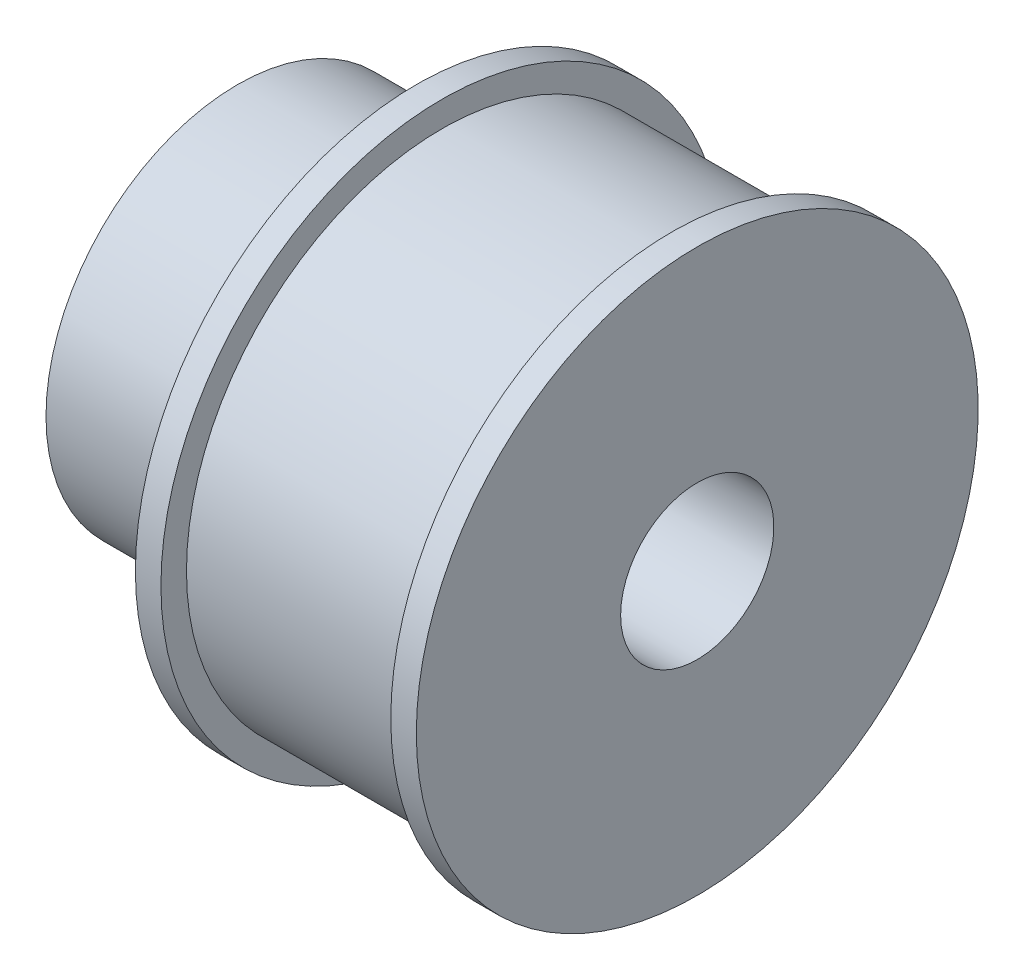
from build123d import *


with BuildPart() as part:
    # Sketch1 → Revolve1 (revolve)
    with BuildSketch(Plane(origin=(0, 0, 0), x_dir=(1, 0, 0), z_dir=(0, 1, 0)), mode=Mode.PRIVATE) as revolve1_sk:
        Polygon((0, 3), (0, 7.5), (7, 7.5), (7, 11), (8, 11), (8, 10), (17, 10), (17, 11), (18, 11), (18, 3), align=None)
    revolve(revolve1_sk.sketch.rotate(Axis((0, 0, 0), (1, 0, 0)), 180), axis=Axis((0, 0, 0), (1, 0, 0)))


solid = part.part
